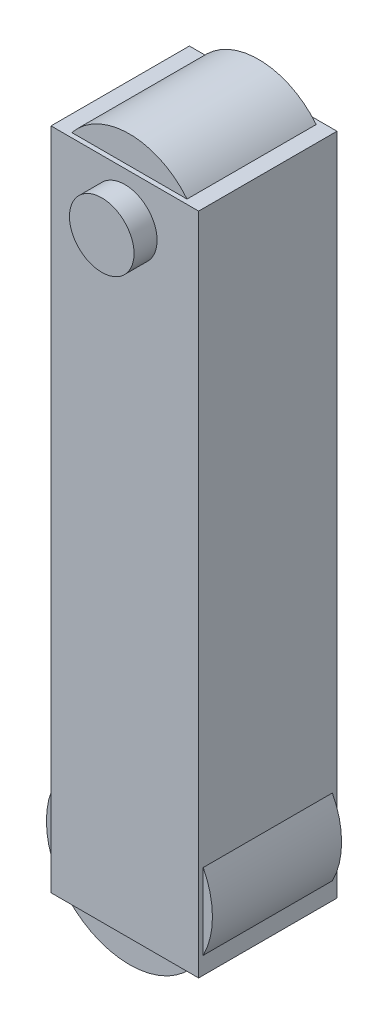
from build123d import *

# Parameters (mm, degrees)
SKETCH1_W           = 32
SKETCH1_H           = 144
BOSS_EXTRUDE1_DEPTH = 15
SKETCH2_R           = 18
BOSS_EXTRUDE2_DEPTH = 14
SKETCH3_R           = 16
BOSS_EXTRUDE3_DEPTH = 14
SKETCH4_R           = 8.25
CUT_EXTRUDE1_DEPTH  = 216.278888886
SKETCH5_R           = 7
BOSS_EXTRUDE4_DEPTH = 20
SKETCH6_R           = 10
CUT_EXTRUDE2_DEPTH  = 216.684955433


with BuildPart() as part:
    # Sketch1 → Boss-Extrude1 (new, symmetric)
    with BuildSketch(Plane.XY):
        with Locations((0, 136)):
            Rectangle(SKETCH1_W, SKETCH1_H)
    extrude(amount=BOSS_EXTRUDE1_DEPTH, both=True)

    # Sketch2 → Boss-Extrude2 (add, symmetric)
    with BuildSketch(Plane.XY):
        with Locations((0, 76)):
            Circle(SKETCH2_R)
    extrude(amount=BOSS_EXTRUDE2_DEPTH, both=True)

    # Sketch3 → Boss-Extrude3 (add, symmetric)
    with BuildSketch(Plane.XY):
        with Locations((0, 198)):
            Circle(SKETCH3_R)
    extrude(amount=BOSS_EXTRUDE3_DEPTH, both=True)

    # Sketch4 → Cut-Extrude1 (cut, through all)
    with BuildSketch(Plane.XY):
        with Locations((0, 76)):
            Circle(SKETCH4_R)
    extrude(amount=-CUT_EXTRUDE1_DEPTH, mode=Mode.SUBTRACT)

    # Sketch5 → Boss-Extrude4 (add, symmetric)
    with BuildSketch(Plane.XY):
        with Locations(Location((0, 198, 0), (0, 0, 180))):
            Circle(SKETCH5_R)
    extrude(amount=BOSS_EXTRUDE4_DEPTH, both=True)

    # Sketch6 → Cut-Extrude2 (cut, through all)
    with BuildSketch(Plane.XY):
        with Locations((0, 118)):
            Circle(SKETCH6_R)
        with Locations((0, 155)):
            Circle(SKETCH6_R)
    extrude(amount=-CUT_EXTRUDE2_DEPTH, mode=Mode.SUBTRACT)


solid = part.part
